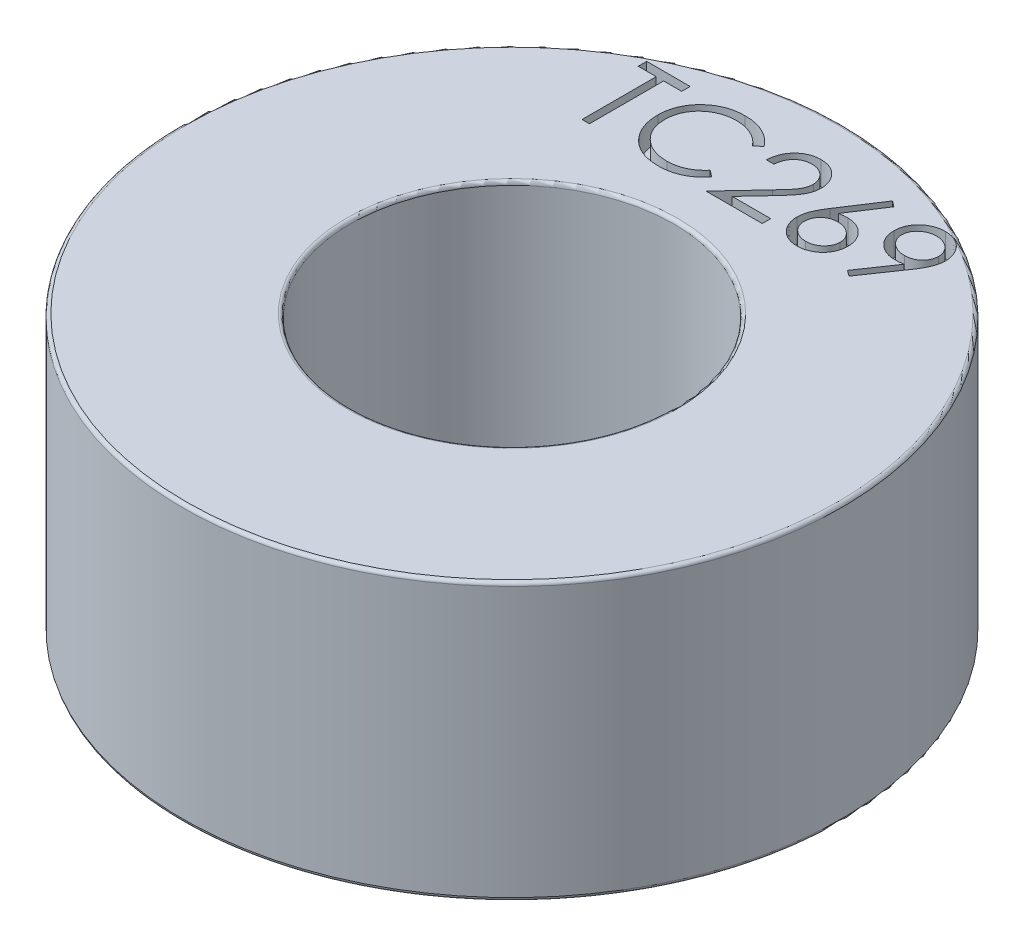
from build123d import *

# Parameters (mm, degrees)
CUT_EXTRUDE1_DEPTH = 1


with BuildPart() as part:
    # Toroidal Core TC269 → Revolve2 (revolve)
    with BuildSketch(Plane.XY, mode=Mode.PRIVATE) as revolve2_sk:
        with BuildLine():
            Line((6.996058459, 0), (13.803941541, 0))
            ThreePointArc((13.803941541, 0), (13.907220468, 0.042779532), (13.95, 0.146058459))
            Line((13.95, 0.146058459), (13.95, 11.553941541))
            ThreePointArc((13.95, 11.553941541), (13.907220468, 11.657220468), (13.803941541, 11.7))
            Line((13.803941541, 11.7), (6.996058459, 11.7))
            ThreePointArc((6.996058459, 11.7), (6.892779532, 11.657220468), (6.85, 11.553941541))
            Line((6.85, 11.553941541), (6.85, 0.146058459))
            ThreePointArc((6.85, 0.146058459), (6.892779532, 0.042779532), (6.996058459, 0))
        make_face()
    revolve(revolve2_sk.sketch.rotate(Axis((0, -8.107972275, 0), (0, 1, 0)), 90), axis=Axis((0, -8.107972275, 0), (0, 1, 0)))

    # Sketch1 → Cut-Extrude1 (cut)
    # profile 1 of 5: a face of its own
    with BuildSketch(Plane(origin=(0, 11.7, 0), x_dir=(1, 0, 0), z_dir=(0, 1, 0))):
        Polygon((-6.38979225, 11.733222949), (-6.38979225, 12.092197308), (-4.55004866, 12.092197308), (-4.55004866, 11.733222949), (-5.312869173, 11.733222949), (-5.312869173, 8.592197308), (-5.626971737, 8.592197308), (-5.626971737, 11.733222949), align=None)
    # profile 2 of 5: a face of its own
    with BuildSketch(Plane(origin=(0, 11.7, 0), x_dir=(1, 0, 0), z_dir=(0, 1, 0))):
        with BuildLine():
            Line((-0.780817891, 11.449969744), (-1.055657634, 11.239633206))
            add(Edge.make_bspline(
                [(-1.055657634, 11.239633206), (-1.075263523, 11.262999176), (-1.114210969, 11.309416091), (-1.176870172, 11.374595636), (-1.242171815, 11.435660897), (-1.310090936, 11.492902777), (-1.381850056, 11.544319543), (-1.455710854, 11.592590646), (-1.532908899, 11.635858384), (-1.639660634, 11.68832137), (-1.779308482, 11.743067525), (-1.955103321, 11.788970756), (-2.13861442, 11.818191932), (-2.26381202, 11.821356773), (-2.32749257, 11.822966539)],
                knots=[0, 0, 0, 0, 0.757959112, 1.505699292, 2.245454638, 2.979532153, 3.711538275, 4.438200793, 5.171680507, 5.909471876, 7.393775596, 8.890124382, 10.418191784, 12, 12, 12, 12], degree=3))
            add(Edge.make_bspline(
                [(-2.32749257, 11.822966539), (-2.36257587, 11.822562577), (-2.432416862, 11.821758401), (-2.536065336, 11.811149276), (-2.637778387, 11.796238066), (-2.737489853, 11.774112742), (-2.835072812, 11.746140123), (-2.931165214, 11.712714709), (-3.024375813, 11.671359869), (-3.115994052, 11.625651609), (-3.203773263, 11.574024165), (-3.28682831, 11.517710813), (-3.364856278, 11.457341716), (-3.43791889, 11.39269061), (-3.506090839, 11.32404865), (-3.56887815, 11.250684308), (-3.62606356, 11.172832134), (-3.678780585, 11.091518727), (-3.725993318, 11.006980935), (-3.765523198, 10.918905865), (-3.80052832, 10.828801762), (-3.828227562, 10.735650601), (-3.850152079, 10.640107835), (-3.865279743, 10.541917047), (-3.875768214, 10.441283368), (-3.876568391, 10.373074055), (-3.876971737, 10.338691699)],
                knots=[0, 0, 0, 0, 1.054917814, 2.100044995, 3.131103042, 4.146048494, 5.169673617, 6.183595914, 7.203665975, 8.234915748, 9.262203917, 10.264457458, 11.251630812, 12.227803204, 13.197192746, 14.159520551, 15.12972552, 16.100847026, 17.073214652, 18.039054194, 19.002613845, 19.979014051, 20.95965708, 21.949030935, 22.966165397, 24, 24, 24, 24], degree=3))
            add(Edge.make_bspline(
                [(-3.876971737, 10.338691699), (-3.875709918, 10.286960379), (-3.873232504, 10.185392795), (-3.851184169, 10.036622184), (-3.817679078, 9.89410151), (-3.767463501, 9.758721668), (-3.705544451, 9.62881331), (-3.627303839, 9.506574457), (-3.536687302, 9.390157892), (-3.432412882, 9.282314944), (-3.318007066, 9.183801219), (-3.195259155, 9.097050637), (-3.064474867, 9.024735755), (-2.927098237, 8.964559808), (-2.782072123, 8.918303081), (-2.62965732, 8.885738957), (-2.470185325, 8.864496777), (-2.361215925, 8.862463089), (-2.305757795, 8.861428078)],
                knots=[0, 0, 0, 0, 1.029171465, 2.020641659, 2.987623507, 3.938342917, 4.889210282, 5.84687017, 6.821220943, 7.821438502, 8.827599549, 9.822697543, 10.807740252, 11.797342354, 12.80366471, 13.83203677, 14.896651826, 16, 16, 16, 16], degree=3))
            add(Edge.make_bspline(
                [(-2.305757795, 8.861428078), (-2.244655106, 8.863116857), (-2.124390397, 8.86644078), (-1.94802237, 8.894600029), (-1.779186605, 8.940257947), (-1.617874018, 9.004155869), (-1.464539372, 9.087221157), (-1.318942712, 9.187919034), (-1.180961141, 9.307207367), (-1.097989859, 9.398290496), (-1.055657634, 9.444761411)],
                knots=[0, 0, 0, 0, 1.028121516, 2.023589091, 2.998037872, 3.967518031, 4.937445131, 5.927275754, 6.942489185, 8, 8, 8, 8], degree=3))
            Line((-1.055657634, 9.444761411), (-0.780817891, 9.236528238))
            add(Edge.make_bspline(
                [(-0.780817891, 9.236528238), (-0.802936001, 9.207989786), (-0.847066276, 9.15104958), (-0.918524293, 9.07077787), (-0.99380159, 8.995273834), (-1.0734573, 8.925146213), (-1.156575092, 8.858991748), (-1.244647404, 8.798689916), (-1.336516437, 8.743399032), (-1.431870916, 8.692772108), (-1.530609528, 8.647854861), (-1.632613963, 8.609401093), (-1.737444539, 8.576276203), (-1.845106047, 8.549024266), (-1.955821804, 8.527753183), (-2.069192278, 8.513533508), (-2.185462153, 8.503791593), (-2.263903575, 8.502903678), (-2.303654429, 8.502453719)],
                knots=[0, 0, 0, 0, 0.986787822, 1.968848986, 2.935600012, 3.899624008, 4.868462664, 5.837806735, 6.815139263, 7.798259679, 8.787526145, 9.778297419, 10.776456485, 11.791383307, 12.812564526, 13.85620153, 14.913611965, 16, 16, 16, 16], degree=3))
            add(Edge.make_bspline(
                [(-2.303654429, 8.502453719), (-2.341298096, 8.502715711), (-2.415733786, 8.503233769), (-2.525632538, 8.511625936), (-2.632622119, 8.523075673), (-2.736396745, 8.540315804), (-2.83752272, 8.560660144), (-2.935083304, 8.587931401), (-3.030038515, 8.618480568), (-3.122006855, 8.654385554), (-3.211066555, 8.694901737), (-3.296930366, 8.740693296), (-3.379558799, 8.791375161), (-3.45976422, 8.845830171), (-3.536361803, 8.905807473), (-3.610015329, 8.970474107), (-3.681137805, 9.039612118), (-3.72514049, 9.089466971), (-3.747264205, 9.114533046)],
                knots=[0, 0, 0, 0, 1.114604814, 2.203992996, 3.262667896, 4.300477797, 5.318619304, 6.316056647, 7.298880507, 8.271930387, 9.238335007, 10.195173496, 11.151986948, 12.108099108, 13.064862484, 14.031167946, 15.010108607, 16, 16, 16, 16], degree=3))
            add(Edge.make_bspline(
                [(-3.747264205, 9.114533046), (-3.782699848, 9.158074234), (-3.853143325, 9.244630945), (-3.943269009, 9.384916926), (-4.020416564, 9.531385135), (-4.082792485, 9.684805064), (-4.131555218, 9.844832451), (-4.165336413, 10.011547965), (-4.187288017, 10.184795908), (-4.189798306, 10.302632696), (-4.191074301, 10.36252984)],
                knots=[0, 0, 0, 0, 0.994628077, 1.977248131, 2.950237994, 3.925870899, 4.908910175, 5.911660606, 6.938484602, 8, 8, 8, 8], degree=3))
            add(Edge.make_bspline(
                [(-4.191074301, 10.36252984), (-4.189519107, 10.425485294), (-4.186459361, 10.549346219), (-4.160463566, 10.731120172), (-4.11864477, 10.905271571), (-4.059247881, 11.071475315), (-3.98394253, 11.230605596), (-3.890915916, 11.3814468), (-3.781248774, 11.5249636), (-3.655801206, 11.658978351), (-3.518233871, 11.781517704), (-3.370915057, 11.889323908), (-3.21413311, 11.979041424), (-3.049615258, 12.054037586), (-2.876129576, 12.111682049), (-2.694046207, 12.152035236), (-2.503707293, 12.177152352), (-2.373844867, 12.18032756), (-2.30786116, 12.181940898)],
                knots=[0, 0, 0, 0, 1.032925535, 2.032216505, 3.007276963, 3.968222605, 4.92396291, 5.891752235, 6.871517503, 7.883894988, 8.900124299, 9.891468569, 10.874487609, 11.85992873, 12.854644235, 13.869047385, 14.917252991, 16, 16, 16, 16], degree=3))
            add(Edge.make_bspline(
                [(-2.30786116, 12.181940898), (-2.267646688, 12.18145876), (-2.188046191, 12.180504416), (-2.070293538, 12.171198274), (-1.955651211, 12.155684668), (-1.844040229, 12.134568598), (-1.734917613, 12.108361276), (-1.629117372, 12.074220978), (-1.526018685, 12.035184447), (-1.426271777, 11.990225981), (-1.330355227, 11.939759239), (-1.238298909, 11.884343616), (-1.15083405, 11.82404781), (-1.067345201, 11.759384635), (-0.98922899, 11.688986076), (-0.914267512, 11.61478848), (-0.845006434, 11.534654655), (-0.802253239, 11.478249722), (-0.780817891, 11.449969744)],
                knots=[0, 0, 0, 0, 1.096760587, 2.17092713, 3.219439832, 4.250915756, 5.268269357, 6.278326846, 7.281116186, 8.274029601, 9.260640565, 10.235837813, 11.203064059, 12.156899882, 13.114053108, 14.069676657, 15.032185724, 16, 16, 16, 16], degree=3))
        make_face()
    # profile 3 of 5: a face of its own
    with BuildSketch(Plane(origin=(0, 11.7, 0), x_dir=(1, 0, 0), z_dir=(0, 1, 0))):
        with BuildLine():
            Line((0.071746212, 11.015274231), (-0.242356352, 11.015274231))
            add(Edge.make_bspline(
                [(-0.242356352, 11.015274231), (-0.240309199, 11.056945119), (-0.236288645, 11.138785634), (-0.217460356, 11.25810954), (-0.190519479, 11.372164339), (-0.152428025, 11.480034253), (-0.105121747, 11.58267306), (-0.04839172, 11.679673076), (0.018802131, 11.770664265), (0.095008865, 11.854803108), (0.177777504, 11.931990679), (0.267083443, 11.998645921), (0.360928471, 12.054963593), (0.45902787, 12.102044835), (0.562488433, 12.137384681), (0.670371291, 12.16360632), (0.783150428, 12.179382666), (0.85999045, 12.181078451), (0.89906993, 12.181940898)],
                knots=[0, 0, 0, 0, 1.10065271, 2.161652631, 3.183658789, 4.190468796, 5.17591951, 6.163126047, 7.15150782, 8.156236427, 9.156009102, 10.134482811, 11.092018607, 12.041330605, 13.001268258, 13.972401359, 14.968799086, 16, 16, 16, 16], degree=3))
            add(Edge.make_bspline(
                [(0.89906993, 12.181940898), (0.937448004, 12.181042442), (1.012859549, 12.179277007), (1.122921563, 12.164115978), (1.227698857, 12.140370386), (1.326986624, 12.10705497), (1.419992689, 12.062270542), (1.507415733, 12.008473004), (1.590296544, 11.946253172), (1.664903328, 11.872999359), (1.733411407, 11.794796974), (1.792513662, 11.711309071), (1.843126825, 11.625079785), (1.885314505, 11.535451583), (1.916370644, 11.441580555), (1.939948852, 11.344833352), (1.953276266, 11.244208541), (1.955321689, 11.176101986), (1.956361596, 11.141476155)],
                knots=[0, 0, 0, 0, 1.111607364, 2.184268762, 3.212621178, 4.221274766, 5.211760367, 6.196651075, 7.1921475, 8.207485113, 9.220403448, 10.201281604, 11.166441695, 12.114753415, 13.065576456, 14.026450734, 14.996634279, 16, 16, 16, 16], degree=3))
            add(Edge.make_bspline(
                [(1.956361596, 11.141476155), (1.954668334, 11.09272832), (1.951311522, 10.996088106), (1.922597146, 10.854073244), (1.877750635, 10.716479824), (1.823753278, 10.605742522), (1.769280834, 10.516509029), (1.720193326, 10.443040324), (1.662728515, 10.363934855), (1.596050017, 10.279457518), (1.521537145, 10.188946613), (1.438514982, 10.092456817), (1.3463915, 9.990985048), (1.281732999, 9.921679446), (1.248228584, 9.88576702)],
                knots=[0, 0, 0, 0, 1.184426356, 2.348067706, 3.509069118, 4.696110526, 5.333549288, 6.050745305, 6.844228056, 7.710549037, 8.667450064, 9.695053472, 10.805634456, 12, 12, 12, 12], degree=3))
            Line((1.248228584, 9.88576702), (0.372527462, 8.951171667))
            Line((0.372527462, 8.951171667), (2.001233391, 8.951171667))
            Line((2.001233391, 8.951171667), (2.001233391, 8.592197308))
            Line((2.001233391, 8.592197308), (-0.376971737, 8.592197308))
            Line((-0.376971737, 8.592197308), (0.980400058, 10.040714937))
            add(Edge.make_bspline(
                [(0.980400058, 10.040714937), (1.013447945, 10.075213243), (1.076926172, 10.14147743), (1.166708749, 10.23822039), (1.247347737, 10.327969931), (1.31936513, 10.410556479), (1.381198635, 10.487188047), (1.436070867, 10.55538275), (1.480036458, 10.618137201), (1.527751854, 10.690877815), (1.573965835, 10.779690132), (1.613678191, 10.888223821), (1.63789304, 10.999951074), (1.640797875, 11.075453111), (1.642259032, 11.113431283)],
                knots=[0, 0, 0, 0, 1.329631726, 2.553950428, 3.673215718, 4.687767853, 5.603093632, 6.413772471, 7.123043292, 7.734684054, 8.834405432, 9.900288307, 10.943827018, 12, 12, 12, 12], degree=3))
            add(Edge.make_bspline(
                [(1.642259032, 11.113431283), (1.64162329, 11.137312681), (1.640370364, 11.184378332), (1.629312667, 11.253384091), (1.61260216, 11.319948904), (1.588656902, 11.384277523), (1.557050162, 11.445723176), (1.518576782, 11.504360656), (1.474186719, 11.561049621), (1.42283545, 11.614202919), (1.36642393, 11.662884124), (1.30682968, 11.70600821), (1.243779576, 11.742047321), (1.177539454, 11.771590818), (1.108293984, 11.794766199), (1.035909239, 11.810824778), (0.960585223, 11.820907262), (0.909151727, 11.822271434), (0.882944129, 11.822966539)],
                knots=[0, 0, 0, 0, 0.991446411, 1.95395049, 2.89581595, 3.838931463, 4.798493298, 5.75982156, 6.748411868, 7.785213223, 8.824556874, 9.840280684, 10.836137867, 11.835679398, 12.848801643, 13.863922112, 14.911575587, 16, 16, 16, 16], degree=3))
            add(Edge.make_bspline(
                [(0.882944129, 11.822966539), (0.855573296, 11.822251507), (0.8018215, 11.820847302), (0.722902467, 11.811024638), (0.647616689, 11.794078797), (0.575774786, 11.770902123), (0.5072552, 11.741443574), (0.442391156, 11.704751829), (0.381328267, 11.660968336), (0.323951744, 11.61132778), (0.271087765, 11.556060179), (0.224640889, 11.494450216), (0.184056875, 11.4276228), (0.148647641, 11.35575825), (0.119891951, 11.27820447), (0.097918801, 11.195236765), (0.080531954, 11.107215383), (0.074723433, 11.046430298), (0.071746212, 11.015274231)],
                knots=[0, 0, 0, 0, 1.031018746, 2.02475058, 2.990194455, 3.934040569, 4.864654155, 5.795059489, 6.735614925, 7.690564532, 8.649604399, 9.611025574, 10.590972636, 11.591080095, 12.624614302, 13.701020113, 14.821632451, 16, 16, 16, 16], degree=3))
        make_face()
    # profile 4 of 5: a face of its own
    with BuildSketch(Plane(origin=(0, 11.7, 0), x_dir=(1, 0, 0), z_dir=(0, 1, 0))):
        with BuildLine():
            Line((3.930720571, 12.181940898), (4.17260759, 11.991936892))
            Line((4.17260759, 11.991936892), (3.247827943, 10.577774231))
            add(Edge.make_bspline(
                [(3.247827943, 10.577774231), (3.30939822, 10.587588092), (3.429498006, 10.606731137), (3.551063905, 10.609889082), (3.610307911, 10.611428078)],
                knots=[0, 0, 0, 0, 1.025318673, 2, 2, 2, 2], degree=3))
            add(Edge.make_bspline(
                [(3.610307911, 10.611428078), (3.645880407, 10.610471966), (3.715903807, 10.608589889), (3.81871061, 10.594106038), (3.917499546, 10.571280926), (4.011861158, 10.53800867), (4.10213414, 10.495506316), (4.188836536, 10.444567445), (4.270338546, 10.382561765), (4.347689725, 10.313296809), (4.417916822, 10.236579825), (4.480092878, 10.155178488), (4.53231967, 10.069177607), (4.574693591, 9.978620741), (4.60759847, 9.883647481), (4.631586115, 9.784379342), (4.645765708, 9.680747871), (4.647691199, 9.610269695), (4.648669289, 9.574468943)],
                knots=[0, 0, 0, 0, 1.04369286, 2.054478336, 3.041073146, 4.015093852, 4.984733326, 5.965804835, 6.960378782, 7.985147595, 9.009457201, 10.008161701, 10.986880575, 11.956520048, 12.937015923, 13.931873656, 14.949455224, 16, 16, 16, 16], degree=3))
            add(Edge.make_bspline(
                [(4.648669289, 9.574468943), (4.647246184, 9.525489239), (4.64444585, 9.429108773), (4.616542054, 9.288732067), (4.573182409, 9.154999551), (4.511204881, 9.03004638), (4.434222498, 8.91404381), (4.340344905, 8.811258345), (4.232901417, 8.719588307), (4.111414619, 8.642931688), (3.980671655, 8.580328637), (3.843319657, 8.535363395), (3.700692511, 8.507679926), (3.603887903, 8.504209323), (3.554919289, 8.502453719)],
                knots=[0, 0, 0, 0, 1.031375318, 2.029502543, 3.004789286, 3.987476834, 4.960371455, 5.9300674, 6.912260825, 7.929083631, 8.949397511, 9.960523116, 10.96833055, 12, 12, 12, 12], degree=3))
            add(Edge.make_bspline(
                [(3.554919289, 8.502453719), (3.507822588, 8.503981924), (3.41453227, 8.507009032), (3.277299476, 8.53397497), (3.145436459, 8.577682073), (3.019867078, 8.637896352), (2.903546465, 8.713954235), (2.799480828, 8.805516514), (2.708189054, 8.910625979), (2.632214433, 9.029266326), (2.571955701, 9.156756284), (2.526765776, 9.28969344), (2.500369532, 9.427593422), (2.496680976, 9.521074561), (2.494823135, 9.568158847)],
                knots=[0, 0, 0, 0, 1.012016664, 2.004627821, 2.994792927, 3.992885782, 4.990978636, 5.973936114, 6.964471063, 7.975201453, 8.993600317, 9.990122807, 10.98767138, 12, 12, 12, 12], degree=3))
            add(Edge.make_bspline(
                [(2.494823135, 9.568158847), (2.49600458, 9.60420343), (2.498416865, 9.677799582), (2.515260255, 9.78926361), (2.54232505, 9.903314692), (2.572635296, 10.000068885), (2.604660906, 10.079330407), (2.631313446, 10.143233898), (2.664487442, 10.208994971), (2.699860823, 10.278868607), (2.740617692, 10.35105404), (2.784933342, 10.426757709), (2.834032992, 10.504775637), (2.868453155, 10.557719832), (2.886049096, 10.584785449)],
                knots=[0, 0, 0, 0, 1.173818275, 2.396712641, 3.66331629, 4.989737886, 5.693666774, 6.447286557, 7.243889047, 8.091586357, 8.998013824, 9.943181721, 10.948533338, 12, 12, 12, 12], degree=3))
            Line((2.886049096, 10.584785449), (3.930720571, 12.181940898))
        make_face()
        with BuildLine():
            add(Edge.make_bspline(
                [(3.544402462, 10.252453719), (3.517740217, 10.251675675), (3.465661108, 10.25015593), (3.389253693, 10.241330678), (3.316940441, 10.224711612), (3.247763308, 10.20354528), (3.183015605, 10.17444222), (3.122226765, 10.139090421), (3.065161713, 10.097469243), (3.012418161, 10.050168332), (2.964598498, 9.998380299), (2.923417367, 9.942910777), (2.887894967, 9.885096574), (2.859013148, 9.824454632), (2.836523073, 9.761008132), (2.820254822, 9.695048883), (2.81120107, 9.626134577), (2.809694839, 9.579402074), (2.808925699, 9.555538655)],
                knots=[0, 0, 0, 0, 1.129588631, 2.206414736, 3.251139165, 4.268635594, 5.265702196, 6.250456724, 7.242448911, 8.251968645, 9.246821453, 10.222880186, 11.173611482, 12.116736599, 13.062300278, 14.020270554, 14.989073742, 16, 16, 16, 16], degree=3))
            add(Edge.make_bspline(
                [(2.808925699, 9.555538655), (2.809552061, 9.531888675), (2.810780262, 9.485514585), (2.821932582, 9.417175405), (2.838967664, 9.351410497), (2.86430806, 9.288558898), (2.894534948, 9.22766258), (2.934440273, 9.170927295), (2.978657058, 9.114907225), (3.031510992, 9.063905753), (3.088234355, 9.016449129), (3.148835557, 8.974968875), (3.211995517, 8.939482702), (3.278566939, 8.911671604), (3.347605323, 8.888847318), (3.419685877, 8.872785838), (3.494858733, 8.863705312), (3.545780671, 8.862197119), (3.571746212, 8.861428078)],
                knots=[0, 0, 0, 0, 0.989467248, 1.94019797, 2.891935182, 3.827694429, 4.772920941, 5.730924762, 6.725747692, 7.756678648, 8.79901574, 9.819492441, 10.826891316, 11.826466727, 12.835195252, 13.867842842, 14.912794438, 16, 16, 16, 16], degree=3))
            add(Edge.make_bspline(
                [(3.571746212, 8.861428078), (3.59771171, 8.862197179), (3.648633565, 8.863705491), (3.723807025, 8.87278516), (3.795885344, 8.888849808), (3.864931852, 8.911662578), (3.931473283, 8.939516187), (3.994578005, 8.974748107), (4.054606099, 9.016704225), (4.111366698, 9.063824653), (4.164000636, 9.115197505), (4.209277915, 9.170427228), (4.247961149, 9.228121123), (4.279395336, 9.288319013), (4.304456627, 9.3514485), (4.321578094, 9.417165224), (4.332707383, 9.48551725), (4.333938749, 9.531889575), (4.334566725, 9.555538655)],
                knots=[0, 0, 0, 0, 1.087397944, 2.132534446, 3.165364764, 4.174271784, 5.174024072, 6.181601208, 7.194203697, 8.236725232, 9.267838612, 10.269026844, 11.221737037, 12.171628256, 13.107553087, 14.05945871, 15.010357665, 16, 16, 16, 16], degree=3))
            add(Edge.make_bspline(
                [(4.334566725, 9.555538655), (4.334016432, 9.579433205), (4.332936385, 9.626330438), (4.320720437, 9.695018056), (4.303778063, 9.761343262), (4.278195032, 9.824889211), (4.244958488, 9.885405139), (4.204475081, 9.94319674), (4.15764251, 9.998707087), (4.103544971, 10.050269895), (4.044654737, 10.097416973), (3.982039151, 10.13903653), (3.916531178, 10.174161506), (3.848197235, 10.203468609), (3.776254353, 10.224618083), (3.701864013, 10.241271326), (3.624074771, 10.250133344), (3.571298162, 10.251670409), (3.544402462, 10.252453719)],
                knots=[0, 0, 0, 0, 0.978206639, 1.919901502, 2.851605144, 3.780102724, 4.718870031, 5.675451981, 6.667674623, 7.690630536, 8.733308323, 9.756129687, 10.767539656, 11.776269907, 12.797430371, 13.836405707, 14.897401972, 16, 16, 16, 16], degree=3))
        make_face(mode=Mode.SUBTRACT)
    # profile 5 of 5: a face of its own
    with BuildSketch(Plane(origin=(0, 11.7, 0), x_dir=(1, 0, 0), z_dir=(0, 1, 0))):
        with BuildLine():
            Line((5.770464161, 8.502453719), (5.519462558, 8.677033046))
            Line((5.519462558, 8.677033046), (6.492619609, 10.099609167))
            add(Edge.make_bspline(
                [(6.492619609, 10.099609167), (6.430528874, 10.092016104), (6.308268754, 10.077064939), (6.185131651, 10.074318284), (6.124530667, 10.072966539)],
                knots=[0, 0, 0, 0, 1.015715272, 2, 2, 2, 2], degree=3))
            add(Edge.make_bspline(
                [(6.124530667, 10.072966539), (6.087788619, 10.073907616), (6.015667192, 10.075754866), (5.90963554, 10.090396675), (5.807749979, 10.112946802), (5.710280623, 10.146595558), (5.616861118, 10.188413767), (5.527695405, 10.24027078), (5.442903515, 10.301277072), (5.363396105, 10.371110063), (5.291084366, 10.447788116), (5.226661068, 10.528943759), (5.173119936, 10.615519729), (5.128643351, 10.705749949), (5.094912897, 10.8009313), (5.070350359, 10.8999807), (5.055228005, 11.003592342), (5.05342891, 11.074117473), (5.052515443, 11.109925674)],
                knots=[0, 0, 0, 0, 1.060718605, 2.082097864, 3.085795603, 4.069760067, 5.054557537, 6.03741023, 7.043284206, 8.066802108, 9.088538119, 10.083643548, 11.053783639, 12.022749082, 12.983451788, 13.964007469, 14.966251758, 16, 16, 16, 16], degree=3))
            add(Edge.make_bspline(
                [(5.052515443, 11.109925674), (5.054249877, 11.158894326), (5.057654221, 11.255009858), (5.085052738, 11.395443627), (5.130113077, 11.528230171), (5.192941454, 11.653020365), (5.272076176, 11.768019104), (5.367184766, 11.871627713), (5.47768873, 11.962372567), (5.601070749, 12.040376644), (5.73442377, 12.103111641), (5.874092428, 12.149350942), (6.019006548, 12.17654969), (6.117174218, 12.180135551), (6.166597975, 12.181940898)],
                knots=[0, 0, 0, 0, 1.022988612, 2.007919123, 2.978103895, 3.94594894, 4.918897164, 5.887013414, 6.875921846, 7.89917871, 8.930658928, 9.948724884, 10.967259574, 12, 12, 12, 12], degree=3))
            add(Edge.make_bspline(
                [(6.166597975, 12.181940898), (6.215086394, 12.180110735), (6.310894941, 12.176494505), (6.451783948, 12.150010536), (6.586724965, 12.105373863), (6.714969951, 12.0436893), (6.833709364, 11.966368392), (6.940485175, 11.874233868), (7.032860714, 11.767228341), (7.110684595, 11.647939851), (7.173154635, 11.51977287), (7.218226918, 11.385988947), (7.245972557, 11.247550226), (7.249468884, 11.153755752), (7.251233391, 11.106420065)],
                knots=[0, 0, 0, 0, 1.026385292, 2.028040595, 3.023318987, 4.028184125, 5.03290303, 6.015178782, 7.004435299, 8.016004309, 9.023023918, 10.015172535, 10.998308025, 12, 12, 12, 12], degree=3))
            add(Edge.make_bspline(
                [(7.251233391, 11.106420065), (7.250054982, 11.069676298), (7.247664875, 10.995150757), (7.230928568, 10.881920414), (7.202508382, 10.766469185), (7.170256684, 10.668747589), (7.139124516, 10.588039139), (7.109823384, 10.524287559), (7.077311231, 10.457186296), (7.039392465, 10.387438958), (6.998630169, 10.314156423), (6.952570892, 10.238073707), (6.90226532, 10.159088714), (6.8664356, 10.105841626), (6.848088359, 10.078575514)],
                knots=[0, 0, 0, 0, 1.179839688, 2.393009684, 3.667231171, 4.993948276, 5.694988576, 6.444077775, 7.246288328, 8.089075292, 8.993003841, 9.939041771, 10.944649915, 12, 12, 12, 12], degree=3))
            Line((6.848088359, 10.078575514), (5.770464161, 8.502453719))
        make_face()
        with BuildLine():
            add(Edge.make_bspline(
                [(6.182723776, 10.431940898), (6.21055779, 10.432701282), (6.264741153, 10.434181491), (6.344118452, 10.443190732), (6.419042656, 10.459164719), (6.489713905, 10.482084431), (6.556840807, 10.5097411), (6.619357135, 10.544953086), (6.67731521, 10.586969721), (6.731103137, 10.634179736), (6.778867137, 10.68663032), (6.821410168, 10.741527426), (6.857570735, 10.799112036), (6.886134012, 10.860105299), (6.909618588, 10.923022507), (6.9258366, 10.988876862), (6.934820933, 11.057325263), (6.936352508, 11.103823921), (6.937130827, 11.127453719)],
                knots=[0, 0, 0, 0, 1.163407946, 2.26475976, 3.333800367, 4.359385343, 5.366239384, 6.363380779, 7.350133999, 8.353570782, 9.349036268, 10.310270964, 11.253520213, 12.184142, 13.120487599, 14.056272588, 15.012232024, 16, 16, 16, 16], degree=3))
            add(Edge.make_bspline(
                [(6.937130827, 11.127453719), (6.936461158, 11.151093384), (6.935141493, 11.197678244), (6.924554193, 11.266227984), (6.90592897, 11.331921245), (6.880938485, 11.395117674), (6.848018247, 11.455298046), (6.808514762, 11.513217918), (6.761582312, 11.568510046), (6.707579746, 11.61987403), (6.649345193, 11.667221929), (6.587284693, 11.709008005), (6.521909776, 11.744029201), (6.453619287, 11.772928171), (6.382270938, 11.795479947), (6.30790695, 11.811697311), (6.230151544, 11.820669066), (6.177370258, 11.82219096), (6.150472173, 11.822966539)],
                knots=[0, 0, 0, 0, 0.972161553, 1.915763587, 2.844109794, 3.775983486, 4.705125789, 5.659731448, 6.655561913, 7.682237399, 8.721216875, 9.739758359, 10.754845918, 11.767244016, 12.7857855, 13.828538656, 14.893392813, 16, 16, 16, 16], degree=3))
            add(Edge.make_bspline(
                [(6.150472173, 11.822966539), (6.12380802, 11.822189707), (6.071493171, 11.82066557), (5.994429011, 11.811714365), (5.920567843, 11.795370881), (5.849426223, 11.772938617), (5.781137763, 11.744027045), (5.71576593, 11.70900617), (5.653690913, 11.667231547), (5.595512192, 11.619836775), (5.54141427, 11.568749129), (5.495288741, 11.5129757), (5.455694849, 11.455328175), (5.422819846, 11.395109667), (5.397817329, 11.331923382), (5.379195327, 11.266227405), (5.368607162, 11.197678395), (5.367287616, 11.151093435), (5.366618007, 11.127453719)],
                knots=[0, 0, 0, 0, 1.099389452, 2.15699305, 3.192601482, 4.213358962, 5.227959689, 6.245255729, 7.266013209, 8.307253147, 9.336162325, 10.327954924, 11.284637477, 12.215801273, 13.149702402, 14.080068371, 15.025723358, 16, 16, 16, 16], degree=3))
            add(Edge.make_bspline(
                [(5.366618007, 11.127453719), (5.367223933, 11.10380552), (5.36841893, 11.057166944), (5.37994672, 10.988640551), (5.399225, 10.922952357), (5.42504439, 10.85946365), (5.45904598, 10.798791792), (5.500769828, 10.74122443), (5.549675374, 10.68610898), (5.605108862, 10.634301768), (5.665777023, 10.586749592), (5.730573769, 10.54521921), (5.798383606, 10.510146766), (5.869445237, 10.482005382), (5.943232037, 10.459393718), (6.020407168, 10.443220173), (6.100715405, 10.434267906), (6.155125387, 10.432724009), (6.182723776, 10.431940898)],
                knots=[0, 0, 0, 0, 0.952633368, 1.87876736, 2.791047057, 3.707742249, 4.635551637, 5.587206343, 6.568248508, 7.601284464, 8.641511608, 9.671105535, 10.699146789, 11.713763218, 12.747829548, 13.806491675, 14.887386225, 16, 16, 16, 16], degree=3))
        make_face(mode=Mode.SUBTRACT)
    extrude(amount=-CUT_EXTRUDE1_DEPTH, mode=Mode.SUBTRACT)


solid = part.part
